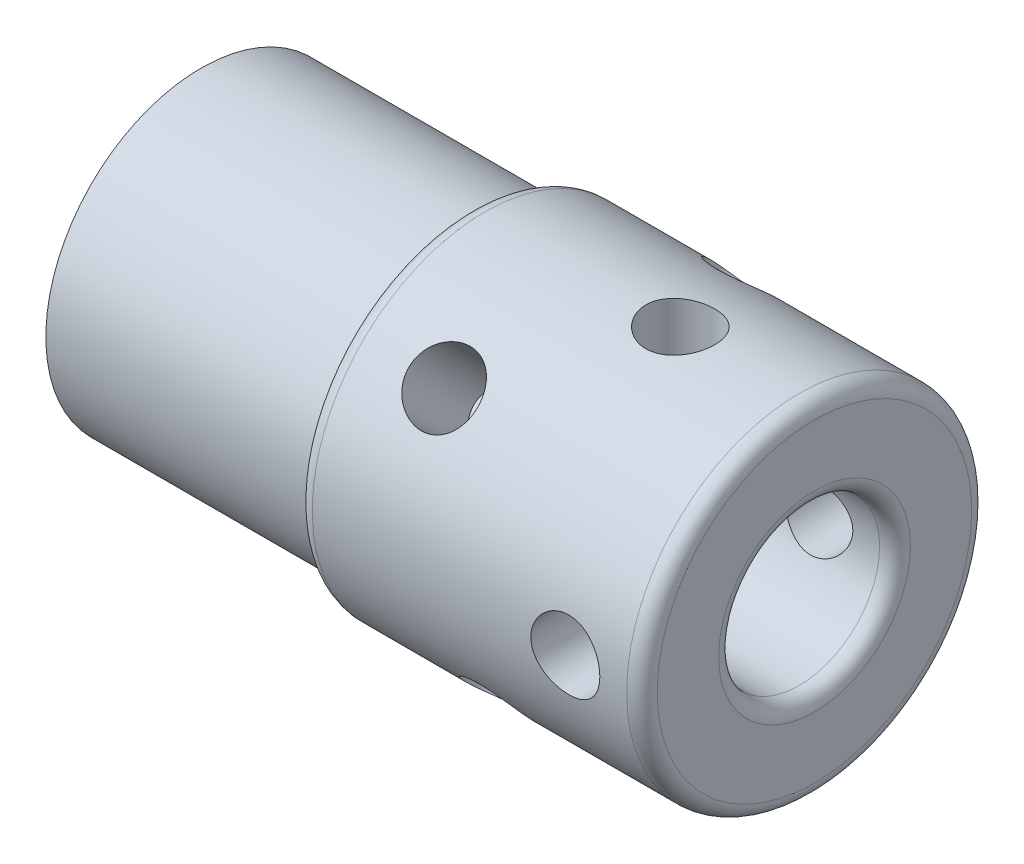
from build123d import *

# Parameters (mm, degrees)
SKETCH1_R               = 4.05
SKETCH1_R_2             = 2.1
BOSS_EXTRUDE1_DEPTH     = 7
SKETCH2_R               = 4.5
SKETCH2_R_2             = 2.1
BOSS_EXTRUDE2_DEPTH     = 9
FILLET1_R               = 0.4
CUT_EXTRUDE1_DEPTH      = 18.219175358
CUT_EXTRUDE1_DEPTH_BACK = 18.219175358
SKETCH3_R               = 0.9
CUT_EXTRUDE2_DEPTH      = 18.219175503
CUT_EXTRUDE2_DEPTH_BACK = 18.219175503
SKETCH4_R               = 0.9
CUT_EXTRUDE3_DEPTH      = 19.631291042
CUT_EXTRUDE3_DEPTH_BACK = 19.631291042
SKETCH6_R               = 0.9
CUT_EXTRUDE4_DEPTH      = 19.631291042
CUT_EXTRUDE4_DEPTH_BACK = 19.631291042
SKETCH7_R               = 0.9
FILLET2_R               = 0.4
FILLET3_R               = 0.4


with BuildPart() as part:
    # Sketch1 → Boss-Extrude1 (new body)
    with BuildSketch(Plane(origin=(0, 0, 0), x_dir=(0, 0, -1), z_dir=(1, 0, 0))):
        Circle(SKETCH1_R)
        Circle(SKETCH1_R_2, mode=Mode.SUBTRACT)
    extrude(amount=BOSS_EXTRUDE1_DEPTH)

    # Sketch2 → Boss-Extrude2 (add)
    with BuildSketch(Plane(origin=(7, 0, 0), x_dir=(0, 0, -1), z_dir=(1, 0, 0))):
        Circle(SKETCH2_R)
        Circle(SKETCH2_R_2, mode=Mode.SUBTRACT)
    extrude(amount=BOSS_EXTRUDE2_DEPTH)

    # Fillet1
    fillet1_edges = [part.edges().sort_by_distance(p)[0] for p in [
        (16, 0, 2.1),
    ]]
    fillet(fillet1_edges, radius=FILLET1_R)

    # Sketch3 → Cut-Extrude1 (cut, two sides: drawn at the far end of the back side and taken through both)
    with BuildSketch(Plane(origin=(0, 0, 0), x_dir=(1, 0, 0), z_dir=(0, 1, 0)).offset(-CUT_EXTRUDE1_DEPTH_BACK)):
        with Locations((12.5, 0)):
            Circle(SKETCH3_R)
    extrude(amount=CUT_EXTRUDE1_DEPTH + CUT_EXTRUDE1_DEPTH_BACK, mode=Mode.SUBTRACT)

    # Sketch4 → Cut-Extrude2 (cut, two sides: drawn at the far end of the back side and taken through both)
    with BuildSketch(Plane.XY.offset(-CUT_EXTRUDE2_DEPTH_BACK)):
        with Locations((14, 0)):
            Circle(SKETCH4_R)
    extrude(amount=CUT_EXTRUDE2_DEPTH + CUT_EXTRUDE2_DEPTH_BACK, mode=Mode.SUBTRACT)

    # Sketch6 → Cut-Extrude3 (cut, two sides: drawn at the far end of the back side and taken through both)
    with BuildSketch(Plane(origin=(0, 2.25, -2.25), x_dir=(1, 0, 0), z_dir=(0, -0.7071067811865488, 0.7071067811865464)).offset(-CUT_EXTRUDE3_DEPTH_BACK)):
        with Locations((11, 0)):
            Circle(SKETCH6_R)
    extrude(amount=CUT_EXTRUDE3_DEPTH + CUT_EXTRUDE3_DEPTH_BACK, mode=Mode.SUBTRACT)

    # Sketch7 → Cut-Extrude4 (cut, two sides: drawn at the far end of the back side and taken through both)
    with BuildSketch(Plane(origin=(0, -2.25, -2.25), x_dir=(1, 0, 0), z_dir=(0, -0.7071067811865438, -0.7071067811865512)).offset(-CUT_EXTRUDE4_DEPTH_BACK)):
        with Locations((9.5, 0)):
            Circle(SKETCH7_R)
    extrude(amount=CUT_EXTRUDE4_DEPTH + CUT_EXTRUDE4_DEPTH_BACK, mode=Mode.SUBTRACT)

    # Fillet2
    fillet2_edges = [part.edges().sort_by_distance(p)[0] for p in [
        (16, 0, 4.5),
    ]]
    fillet(fillet2_edges, radius=FILLET2_R)

    # Fillet3
    fillet3_edges = [part.edges().sort_by_distance(p)[0] for p in [
        (7, 0, 4.5),
    ]]
    fillet(fillet3_edges, radius=FILLET3_R)


solid = part.part
